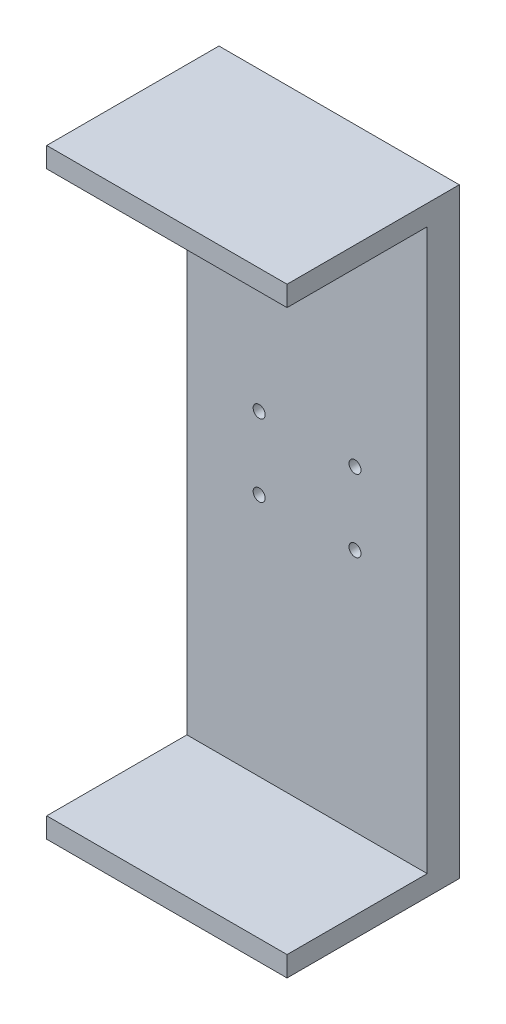
from build123d import *

# Parameters (mm, degrees)
SKETCH2_W           = 60
SKETCH2_H           = 150
SKETCH2_R           = 1.5
BOSS_EXTRUDE1_DEPTH = 8
SKETCH5_W           = 60
SKETCH5_H           = 5.066428815
BOSS_EXTRUDE2_DEPTH = 35


with BuildPart() as part:
    # Sketch2 → Boss-Extrude1 (new body)
    with BuildSketch(Plane.XY):
        with Locations((16.635, 15)):
            Rectangle(SKETCH2_W, SKETCH2_H)
        with Locations((28.6, 24.016821687)):
            Circle(SKETCH2_R, mode=Mode.SUBTRACT)
        with Locations(Location((28.6, 5.983178313, 0), (0, 0, 180))):
            Circle(SKETCH2_R, mode=Mode.SUBTRACT)
        with Locations((4.67, 5.983178313)):
            Circle(SKETCH2_R, mode=Mode.SUBTRACT)
        with Locations(Location((4.67, 24.016821687, 0), (0, 0, 180))):
            Circle(SKETCH2_R, mode=Mode.SUBTRACT)
    extrude(amount=BOSS_EXTRUDE1_DEPTH)

    # Sketch5 → Boss-Extrude2 (add)
    with BuildSketch(Plane.XY.offset(8)):
        with Locations((16.635, 87.466785593)):
            Rectangle(SKETCH5_W, SKETCH5_H)
        with Locations((16.635, -57.466785593)):
            Rectangle(SKETCH5_W, SKETCH5_H)
    extrude(amount=BOSS_EXTRUDE2_DEPTH)


solid = part.part
